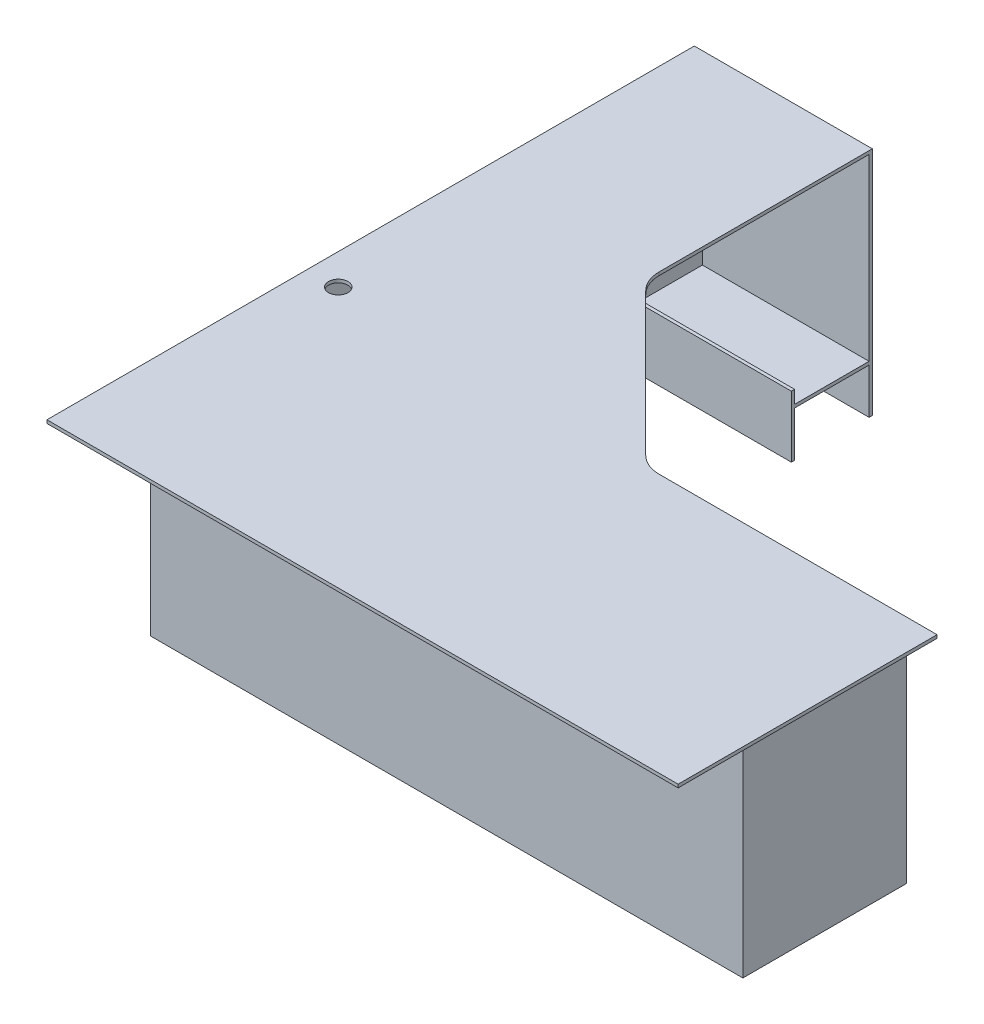
from build123d import *

# Parameters (mm, degrees)
SALIENTE_EXTRUIR1_DEPTH = 10
SALIENTE_EXTRUIR2_DEPTH = 703.6
CROQUIS3_R              = 30
CORTAR_EXTRUIR1_DEPTH   = 2881.547336879
REDONDEO1_R             = 100
SALIENTE_EXTRUIR3_DEPTH = 515
CROQUIS5_W              = 515
CROQUIS5_H              = 10
SALIENTE_EXTRUIR4_DEPTH = 40
CROQUIS6_W              = 330
CROQUIS6_H              = 495
SALIENTE_EXTRUIR5_DEPTH = 150
CROQUIS7_R              = 10
SALIENTE_EXTRUIR6_DEPTH = 30
CROQUIS8_W              = 515
CROQUIS8_H              = 10
SALIENTE_EXTRUIR7_DEPTH = 513.6


with BuildPart() as part:
    # Croquis1 → Saliente-Extruir1 (new body)
    with BuildSketch(Plane(origin=(0, 0, 0), x_dir=(1, 0, 0), z_dir=(0, 1, 0))):
        Polygon((0, 0), (0, 2000), (550, 2000), (550, 1300), (1050, 800), (1950, 800), (1950, 0), align=None)
    extrude(amount=SALIENTE_EXTRUIR1_DEPTH)

    # Croquis2 → Saliente-Extruir2 (add)
    with BuildSketch(Plane.XZ):
        Polygon((25, -295), (1855, -295), (1855, -800), (1845, -800), (1845, -305), (35, -305), (35, -2000), (25, -2000), align=None)
    extrude(amount=SALIENTE_EXTRUIR2_DEPTH)

    # Croquis3 → Cortar-Extruir1 (cut, through all)
    with BuildSketch(Plane.XZ):
        with Locations(Location((95, -805, 0), (0, 0, 270))):
            Circle(CROQUIS3_R)
    extrude(amount=-CORTAR_EXTRUIR1_DEPTH, mode=Mode.SUBTRACT)

    # Redondeo1
    redondeo1_edges = [part.edges().sort_by_distance(p)[0] for p in [
        (550, 5, -1300),
        (1050, 5, -800),
    ]]
    fillet(redondeo1_edges, radius=REDONDEO1_R)

    # Croquis4 → Saliente-Extruir3 (add)
    with BuildSketch(Plane(origin=(35, 0, 0), x_dir=(0, 0, -1), z_dir=(1, 0, 0))):
        Polygon((1750, -703.6), (1750, -553.6), (2000, -553.6), (2000, -703.6), (1990, -703.6), (1990, -563.6), (1760, -563.6), (1760, -703.6), align=None)
    extrude(amount=SALIENTE_EXTRUIR3_DEPTH)

    # Croquis5 → Saliente-Extruir4 (add)
    with BuildSketch(Plane(origin=(0, -553.6, 0), x_dir=(1, 0, 0), z_dir=(0, 1, 0))):
        with Locations((292.5, 1995)):
            Rectangle(CROQUIS5_W, CROQUIS5_H)
        with Locations((292.5, 1755)):
            Rectangle(CROQUIS5_W, CROQUIS5_H)
    extrude(amount=SALIENTE_EXTRUIR4_DEPTH)

    # Croquis8 → Saliente-Extruir7 (add)
    with BuildSketch(Plane(origin=(0, -513.6, 0), x_dir=(1, 0, 0), z_dir=(0, 1, 0))):
        with Locations((292.5, 1995)):
            Rectangle(CROQUIS8_W, CROQUIS8_H)
    extrude(amount=SALIENTE_EXTRUIR7_DEPTH)


with BuildPart() as body_2:
    # Croquis6 → Saliente-Extruir5 (new body)
    with BuildSketch(Plane.XZ):
        with Locations((1680, -552.5)):
            Rectangle(CROQUIS6_W, CROQUIS6_H)
    extrude(amount=SALIENTE_EXTRUIR5_DEPTH)


with BuildPart() as body_3:
    # Croquis7 → Saliente-Extruir6 (new body)
    with BuildSketch(Plane(origin=(0, 0, -800), x_dir=(-1, 0, 0), z_dir=(0, 0, -1))):
        with Locations((-1630, -75)):
            Circle(CROQUIS7_R)
    extrude(amount=SALIENTE_EXTRUIR6_DEPTH)


solid = Compound([part.part, body_2.part, body_3.part])
